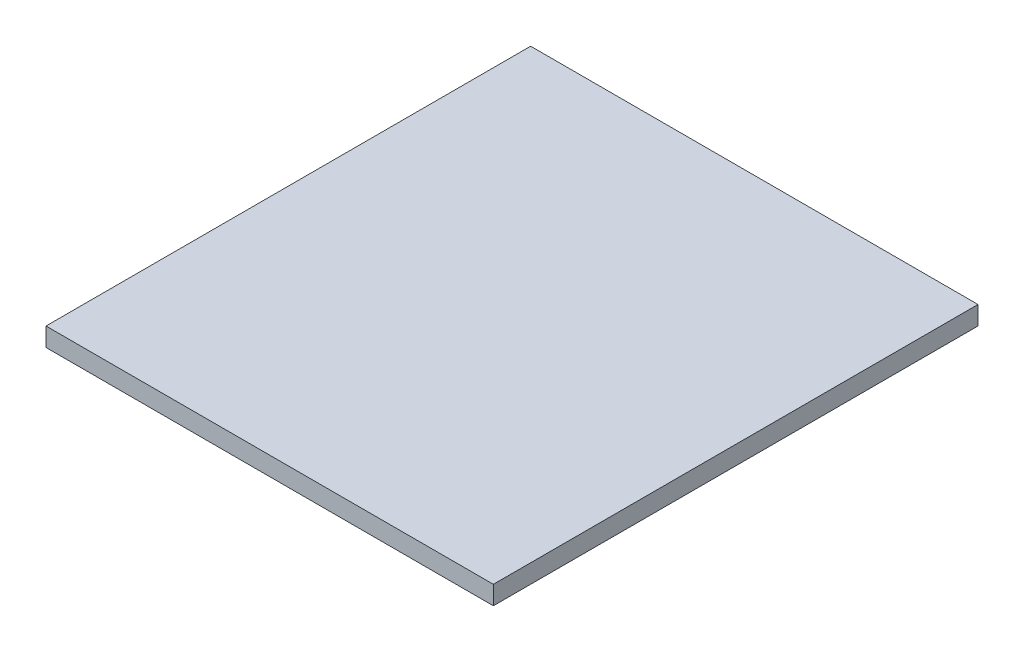
from build123d import *

# Parameters (mm, degrees)
SKETCH1_W           = 228.6
SKETCH1_H           = 247.65
BOSS_EXTRUDE1_DEPTH = 9.525


with BuildPart() as part:
    # Sketch1 → Boss-Extrude1 (new body)
    with BuildSketch(Plane(origin=(0, 0, 0), x_dir=(1, 0, 0), z_dir=(0, 1, 0))):
        Rectangle(SKETCH1_W, SKETCH1_H)
    extrude(amount=BOSS_EXTRUDE1_DEPTH)


solid = part.part
